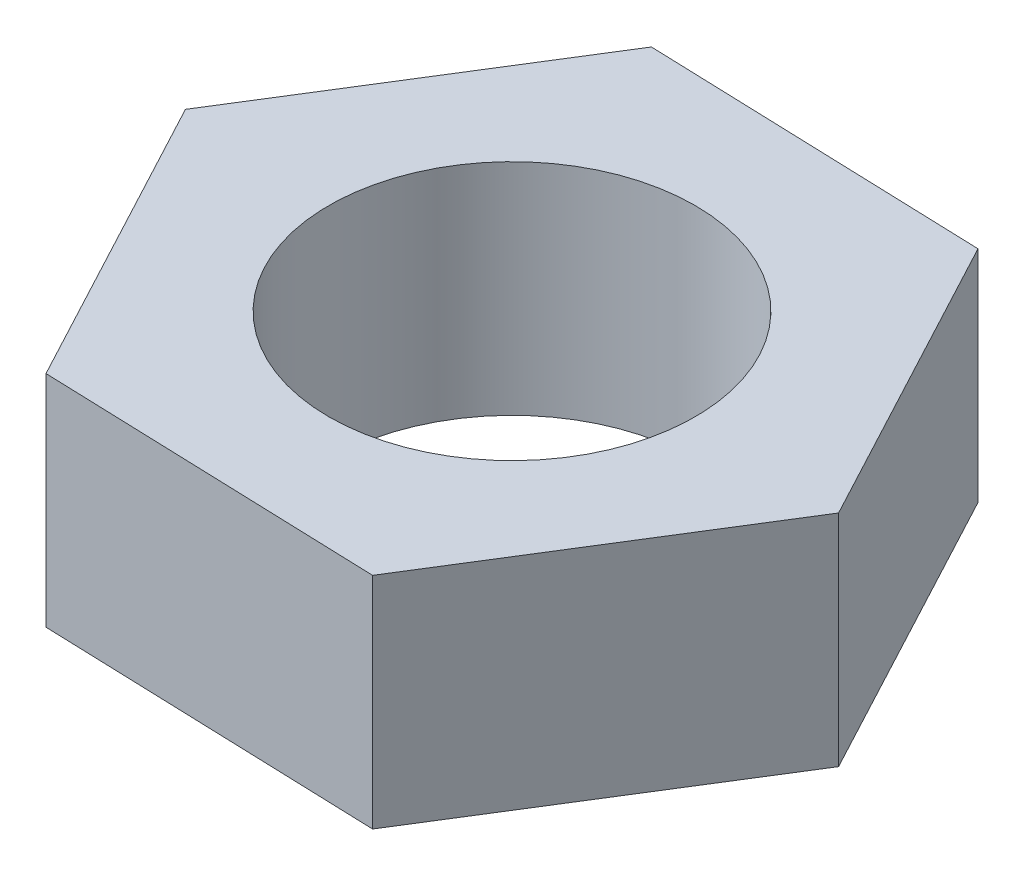
from build123d import *

# Parameters (mm, degrees)
EXTRUDE_1_DEPTH     = 3
SKETCH_2_R          = 4
EXTRUDE_2_DEPTH     = 1
SKETCH_4_R          = 2.5
CUT_EXTRUDE_1_DEPTH = 8.343256039
CUT_EXTRUDE_2_DEPTH = 10


with BuildPart() as part:
    # 草图1 → 凸台-拉伸1 (new body)
    with BuildSketch(Plane(origin=(0, 0, 0), x_dir=(1, 0, 0), z_dir=(0, 1, 0))):
        Polygon((2.443890859, 3.919276822), (-2.172247863, 4.076109979), (-4.616138721, 0.156833157), (-2.443890859, -3.919276822), (2.172247863, -4.076109979), (4.616138721, -0.156833157), align=None)
    extrude(amount=EXTRUDE_1_DEPTH)

    # 草图2 → 凸台-拉伸2 (add)
    with BuildSketch(Plane(origin=(0, 3, 0), x_dir=(1, 0, 0), z_dir=(0, 1, 0))):
        with Locations(Location((0, 0, 0), (0, 0, 88.054126305))):
            Circle(SKETCH_2_R)
    extrude(amount=EXTRUDE_2_DEPTH)

    # 草图4 → 切除-拉伸1 (cut, through all)
    with BuildSketch(Plane(origin=(0, 4, 0), x_dir=(1, 0, 0), z_dir=(0, 1, 0))):
        with Locations(Location((0, 0, 0), (0, 0, 270))):
            Circle(SKETCH_4_R)
    extrude(amount=-CUT_EXTRUDE_1_DEPTH, mode=Mode.SUBTRACT)

    # 草图5 → 切除-拉伸2 (cut)
    with BuildSketch(Plane(origin=(0, 3, 0), x_dir=(1, 0, 0), z_dir=(0, 1, 0))):
        Polygon((2.172247863, -4.076109979), (4.616138721, -0.156833157), (2.443890859, 3.919276822), (-2.172247863, 4.076109979), (-4.616138721, 0.156833157), (-2.443890859, -3.919276822), align=None)
    extrude(amount=CUT_EXTRUDE_2_DEPTH, mode=Mode.SUBTRACT)


solid = part.part
